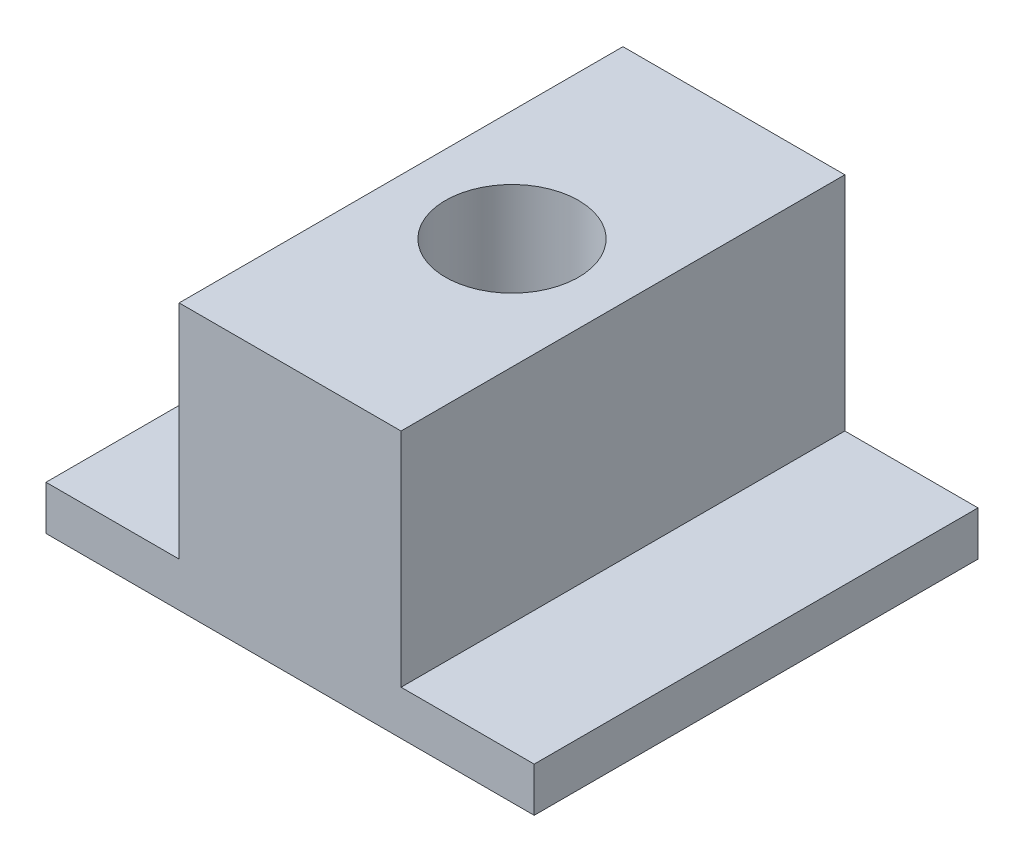
from build123d import *

# Parameters (mm, degrees)
SKETCH1_W           = 5
SKETCH1_H           = 10
BOSS_EXTRUDE1_DEPTH = 5
SKETCH2_W           = 11
SKETCH2_H           = 10
BOSS_EXTRUDE2_DEPTH = 1
SKETCH3_R           = 1.5
CUT_EXTRUDE1_DEPTH  = 10.552486587


with BuildPart() as part:
    # Sketch1 → Boss-Extrude1 (new body)
    with BuildSketch(Plane(origin=(0, 0, 0), x_dir=(1, 0, 0), z_dir=(0, 1, 0))):
        Rectangle(SKETCH1_W, SKETCH1_H)
    extrude(amount=BOSS_EXTRUDE1_DEPTH)

    # Sketch2 → Boss-Extrude2 (add)
    with BuildSketch(Plane.XZ):
        Rectangle(SKETCH2_W, SKETCH2_H)
    extrude(amount=BOSS_EXTRUDE2_DEPTH)

    # Sketch3 → Cut-Extrude1 (cut, through all)
    with BuildSketch(Plane.XZ.offset(1)):
        with Locations(Location((0, 0, 0), (0, 0, 270))):
            Circle(SKETCH3_R)
    extrude(amount=-CUT_EXTRUDE1_DEPTH, mode=Mode.SUBTRACT)


solid = part.part
